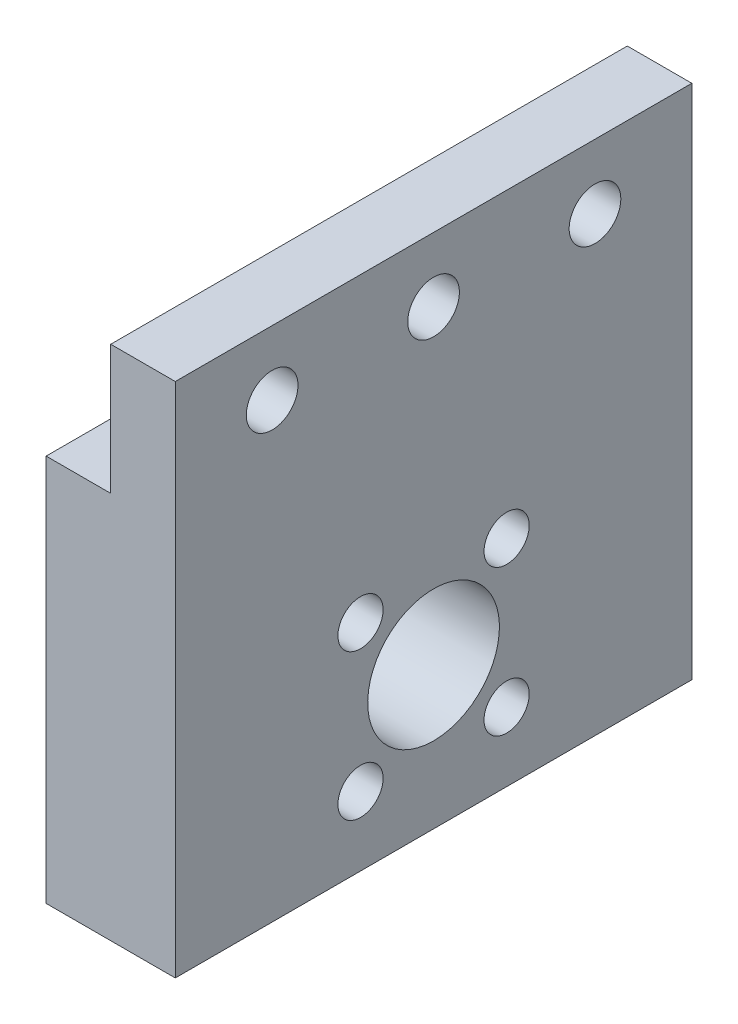
from build123d import *

# Parameters (mm, degrees)
BOSS_EXTRUDE1_DEPTH      = 20
SKETCH2_R                = 5.1
SKETCH2_R_2              = 1.75
CUT_EXTRUDE1_DEPTH       = 79.89866919
CUT_EXTRUDE2_DEPTH       = 92.241437954
F_4_0_4_DIAMETER_HOLE1_D = 4


with BuildPart() as part:
    # Sketch1 → Boss-Extrude1 (new, symmetric)
    with BuildSketch(Plane.XY):
        Polygon((0, 0), (0, 65), (-50, 65), (-50, 55), (-10, 55), (-10, 0), align=None)
    extrude(amount=BOSS_EXTRUDE1_DEPTH, both=True)

    # Sketch2 → Cut-Extrude1 (cut, through all)
    with BuildSketch(Plane.ZY.offset(10)):
        with Locations(Location((0, 11, 0), (0, 0, 270))):
            Circle(SKETCH2_R)
        with Locations(Location((5.656854249, 16.656854249, 0), (0, 0, 270))):
            Circle(SKETCH2_R_2)
        with Locations(Location((5.656854249, 5.343145751, 0), (0, 0, 270))):
            Circle(SKETCH2_R_2)
        with Locations(Location((-5.656854249, 16.656854249, 0), (0, 0, 270))):
            Circle(SKETCH2_R_2)
        with Locations(Location((-5.656854249, 5.343145751, 0), (0, 0, 270))):
            Circle(SKETCH2_R_2)
    extrude(amount=-CUT_EXTRUDE1_DEPTH, mode=Mode.SUBTRACT)

    # Sketch3 → Cut-Extrude2 (cut, through all)
    with BuildSketch(Plane.XY.offset(20)):
        Polygon((-50, 65), (0, 65), (0, 40), (-5, 40), (-5, 30), (-10, 30), (-10, 55), (-50, 55), align=None)
    extrude(amount=-CUT_EXTRUDE2_DEPTH, mode=Mode.SUBTRACT)

    # Ø4.0 (4) Diameter Hole1 (through all)
    with Locations(Plane(origin=(0, 0, 0), x_dir=(0, 0, -1), z_dir=(1, 0, 0))):
        with Locations((-12.5, 35), (0, 35), (12.5, 35)):
            Hole(F_4_0_4_DIAMETER_HOLE1_D / 2)


solid = part.part
